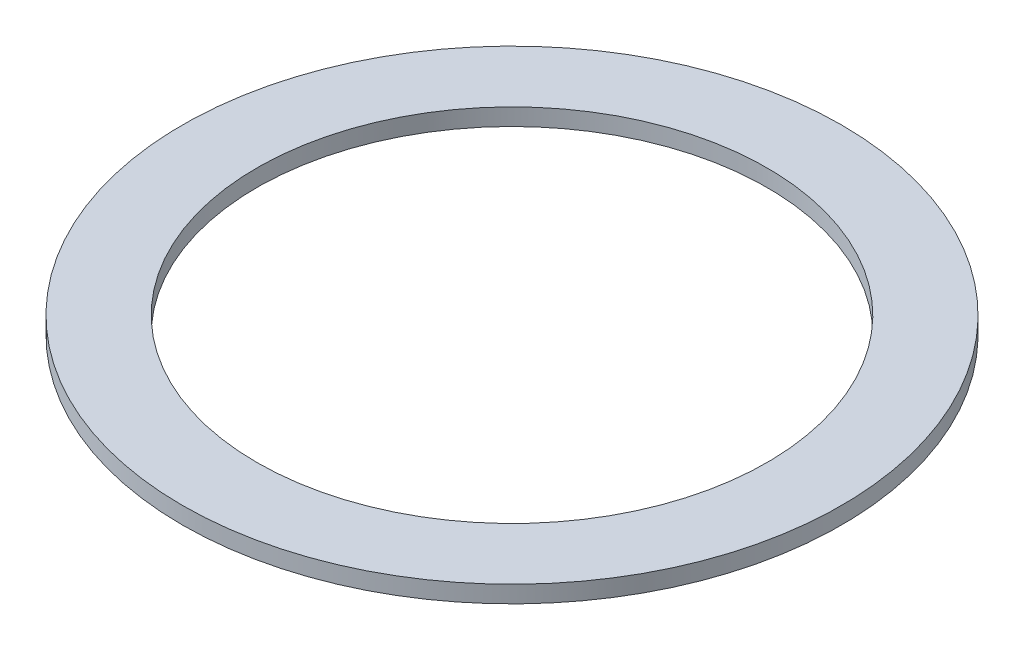
from build123d import *

# Parameters (mm, degrees)
SKETCH1_R           = 77.5
SKETCH1_R_2         = 60
BOSS_EXTRUDE1_DEPTH = 4


with BuildPart() as part:
    # Sketch1 → Boss-Extrude1 (new body)
    with BuildSketch(Plane(origin=(0, 0, 0), x_dir=(1, 0, 0), z_dir=(0, 1, 0))):
        with Locations(Location((0, 0, 0), (0, 0, 270))):
            Circle(SKETCH1_R)
        with Locations(Location((0, 0, 0), (0, 0, 270))):
            Circle(SKETCH1_R_2, mode=Mode.SUBTRACT)
    extrude(amount=BOSS_EXTRUDE1_DEPTH)


solid = part.part
